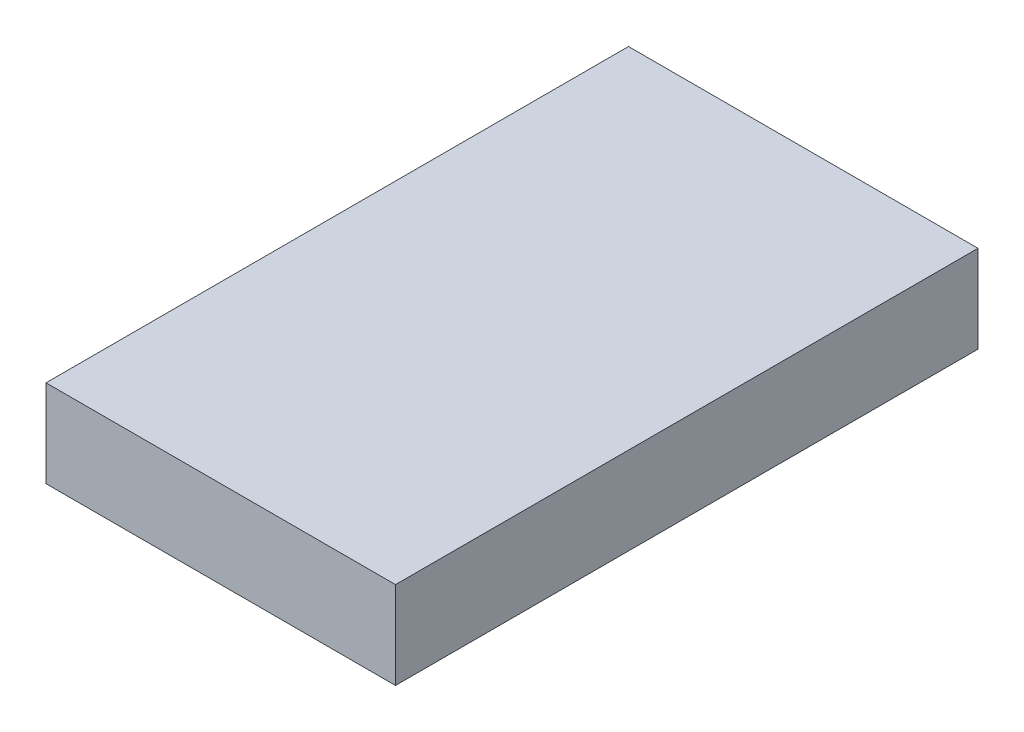
from build123d import *

# Parameters (mm, degrees)
BOSS_EXTRUDE2_DEPTH      = 60
BOSS_EXTRUDE2_DEPTH_BACK = 60
SKETCH1_W                = 30
SKETCH1_H                = 200


with BuildPart() as part:
    # Sketch1 → Boss-Extrude2 (new, two sides: drawn at the far end of the back side and taken through both)
    with BuildSketch(Plane.YZ.offset(-BOSS_EXTRUDE2_DEPTH_BACK)):
        with Locations((15, 250)):
            Rectangle(SKETCH1_W, SKETCH1_H)
    extrude(amount=BOSS_EXTRUDE2_DEPTH + BOSS_EXTRUDE2_DEPTH_BACK)


solid = part.part
